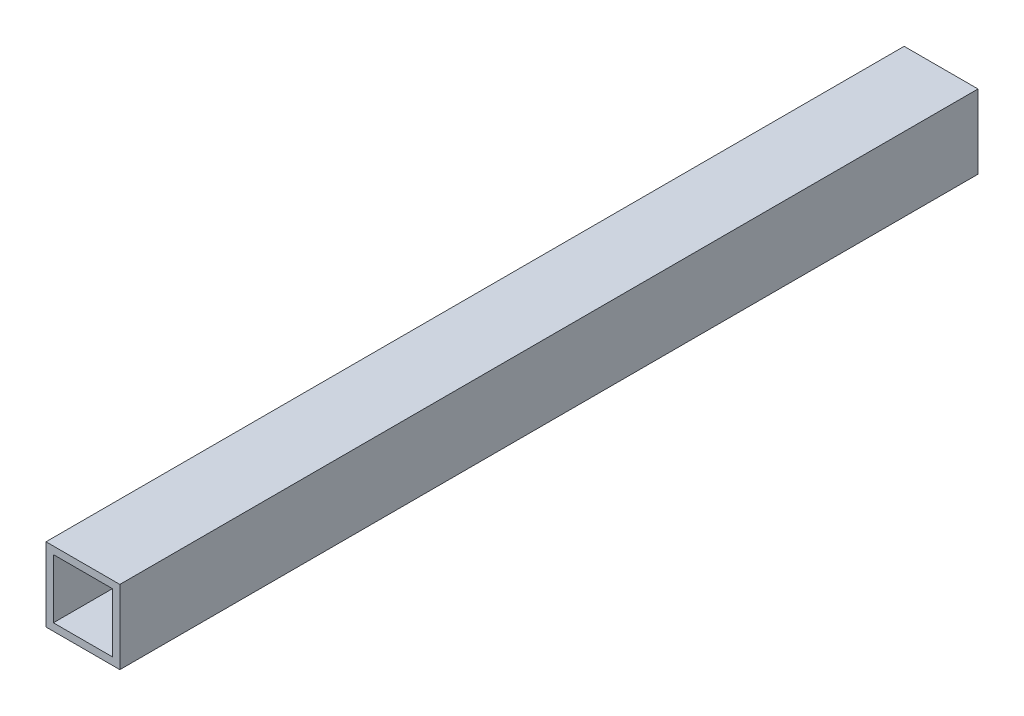
from build123d import *

# Parameters (mm, degrees)
SKETCH1_W           = 20
SKETCH1_H           = 20
SKETCH1_W_2         = 16
SKETCH1_H_2         = 16
EXTRUDE_THIN1_DEPTH = 232.4


with BuildPart() as part:
    # Sketch1 → Extrude-Thin1 (new body)
    with BuildSketch(Plane.XY):
        with Locations((10, 10)):
            Rectangle(SKETCH1_W, SKETCH1_H)
        with Locations((10, 10)):
            Rectangle(SKETCH1_W_2, SKETCH1_H_2, mode=Mode.SUBTRACT)
    extrude(amount=EXTRUDE_THIN1_DEPTH)


solid = part.part
